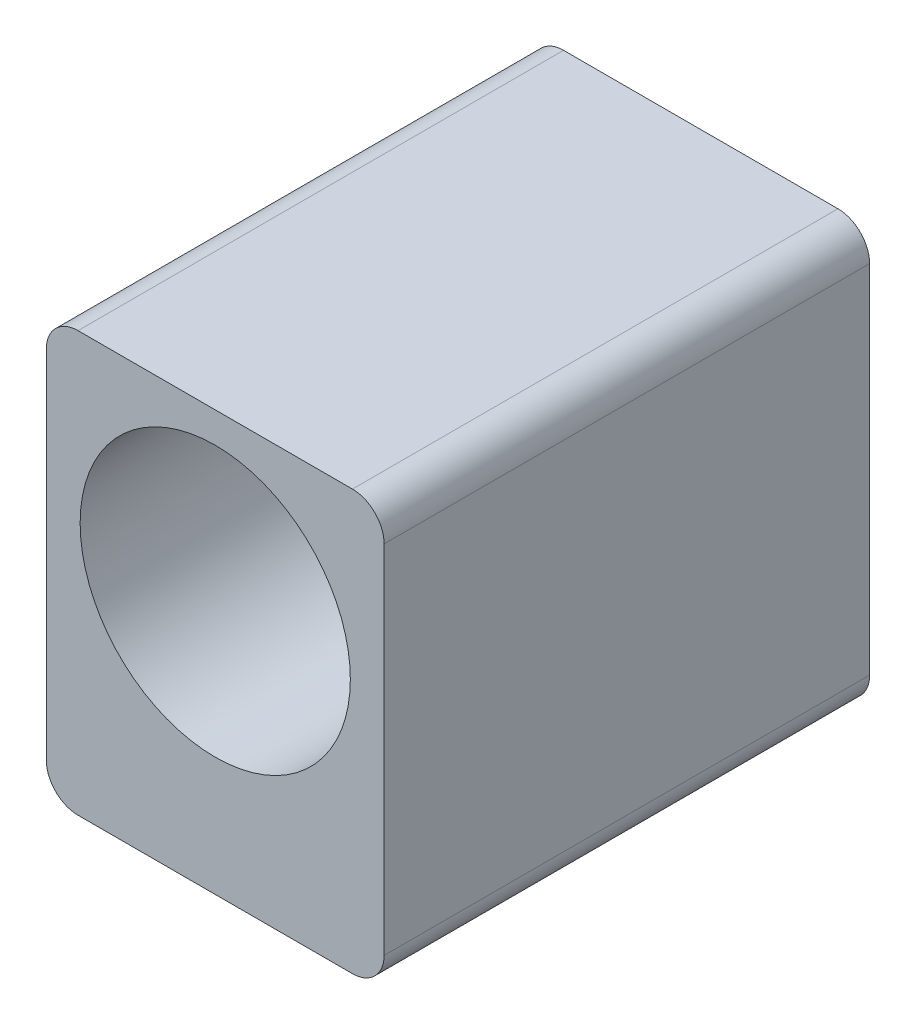
from build123d import *

# Parameters (mm, degrees)
SKETCH1_R           = 12.8
BOSS_EXTRUDE1_DEPTH = 23
SKETCH2_R           = 2
CUT_EXTRUDE1_DEPTH  = 9


with BuildPart() as part:
    # Sketch1 → Boss-Extrude1 (new, symmetric)
    with BuildSketch(Plane.XY):
        with BuildLine():
            Line((-13, -24.064), (13, -24.064))
            ThreePointArc((13, -24.064), (15.121320344, -23.185320344), (16, -21.064))
            Line((16, -21.064), (16, 12.7))
            ThreePointArc((16, 12.7), (15.121320344, 14.821320344), (13, 15.7))
            Line((13, 15.7), (-13, 15.7))
            ThreePointArc((-13, 15.7), (-15.121320344, 14.821320344), (-16, 12.7))
            Line((-16, 12.7), (-16, -21.064))
            ThreePointArc((-16, -21.064), (-15.121320344, -23.185320344), (-13, -24.064))
        make_face()
        Circle(SKETCH1_R, mode=Mode.SUBTRACT)
    extrude(amount=BOSS_EXTRUDE1_DEPTH, both=True)

    # Sketch2 → Cut-Extrude1 (cut)
    with BuildSketch(Plane(origin=(0, -24.064, 0), x_dir=(1, 0, 0), z_dir=(0, 1, 0))):
        with Locations(Location((12, -17.5, 0), (0, 0, 60))):
            Circle(SKETCH2_R)
        with Locations(Location((-12, 17.5, 0), (0, 0, 120))):
            Circle(SKETCH2_R)
    extrude(amount=CUT_EXTRUDE1_DEPTH, mode=Mode.SUBTRACT)


solid = part.part
